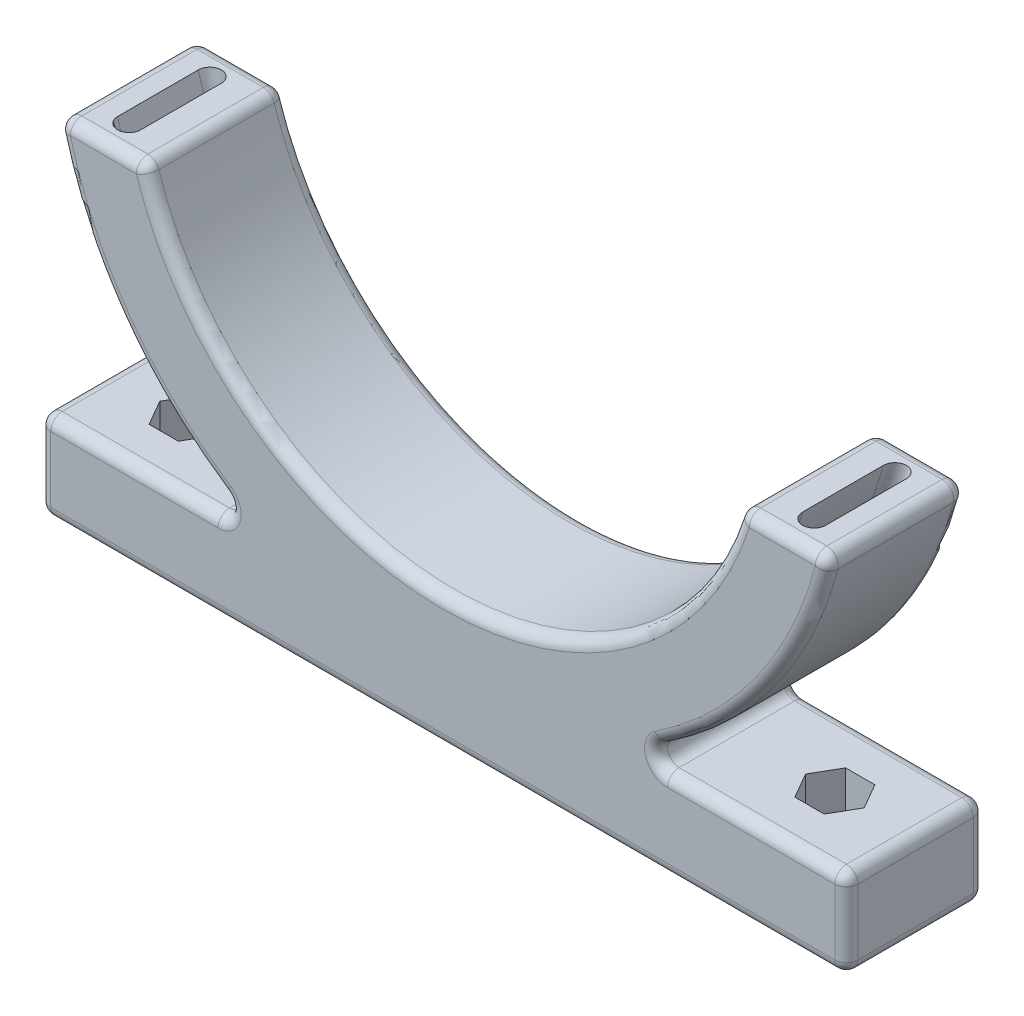
from build123d import *

# Parameters (mm, degrees)
BOSS_EXTRUDE1_DEPTH          = 15.24
FILLET1_R                    = 2.54
CUT_EXTRUDE1_DEPTH           = 10.16
H_0_266_DIAMETER_HOLE1_D     = 6.7564
H_0_266_DIAMETER_HOLE1_DEPTH = 19.558


with BuildPart() as part:
    # Sketch1 → Boss-Extrude1 (new, symmetric)
    with BuildSketch(Plane.XY):
        with BuildLine():
            Line((-85.274045735, -19.05), (-65.616612043, -19.05))
            ThreePointArc((-65.616612043, -19.05), (0, -68.326), (65.616612043, -19.05))
            Line((65.616612043, -19.05), (85.274045735, -19.05))
            ThreePointArc((85.274045735, -19.05), (0, -87.376), (-85.274045735, -19.05))
        make_face()
        with BuildLine():
            ThreePointArc((40.165544525, -77.597), (0, -87.376), (-40.165544525, -77.597))
            Line((-40.165544525, -77.597), (-88.9, -77.597))
            Line((-88.9, -77.597), (-88.9, -97.155))
            Line((-88.9, -97.155), (88.9, -97.155))
            Line((88.9, -97.155), (88.9, -77.597))
            Line((88.9, -77.597), (40.165544525, -77.597))
        make_face()
    extrude(amount=BOSS_EXTRUDE1_DEPTH, both=True)

    # Cut-Sweep1: sweep along a path in Sketch4
    with BuildLine(Plane.XY) as cut_sweep1_path:
        CenterArc((0, 0), 77.978, 0, 360)
    # Sketch3 → Cut-Sweep1 (sweep, cut)
    with BuildSketch(Plane(origin=(0, -19.05, 0), x_dir=(1, 0, 0), z_dir=(0, 1, 0))):
        with BuildLine():
            Line((-77.985328889, -8.89), (-77.985328889, 8.89))
            ThreePointArc((-77.985328889, 8.89), (-75.445328889, 11.43), (-72.905328889, 8.89))
            Line((-72.905328889, 8.89), (-72.905328889, -8.89))
            ThreePointArc((-72.905328889, -8.89), (-75.445328889, -11.43), (-77.985328889, -8.89))
        make_face()
    sweep(path=cut_sweep1_path.line, mode=Mode.SUBTRACT)

    # Fillet1
    fillet1_edges = [part.edges().sort_by_distance(p)[0] for p in [
        (0, -68.326, -15.24),
        (75.445328889, -19.05, -15.24),
        (69.214958668, -53.327805811, -15.24),
        (64.532772263, -77.597, -15.24),
        (-64.532772263, -77.597, 15.24),
        (88.9, -87.376, -15.24),
        (0, -97.155, -15.24),
        (-88.9, -87.376, -15.24),
        (-64.532772263, -77.597, -15.24),
        (-69.214958668, -53.327805811, -15.24),
        (-75.445328889, -19.05, -15.24),
        (-88.9, -87.376, 15.24),
        (-65.616612043, -19.05, 0),
        (65.616612043, -19.05, 0),
        (85.274045735, -19.05, 0),
        (40.165544525, -77.597, 0),
        (88.9, -77.597, 0),
        (88.9, -97.155, 0),
        (-88.9, -97.155, 0),
        (-88.9, -77.597, 0),
        (-40.165544525, -77.597, 0),
        (-85.274045735, -19.05, 0),
        (0, -97.155, 15.24),
        (88.9, -87.376, 15.24),
        (64.532772263, -77.597, 15.24),
        (69.214958668, -53.327805811, 15.24),
        (75.445328889, -19.05, 15.24),
        (0, -68.326, 15.24),
        (-75.445328889, -19.05, 15.24),
        (-69.214958668, -53.327805811, 15.24),
    ]]
    fillet(fillet1_edges, radius=FILLET1_R)

    # Sketch5 → Cut-Extrude1 (cut)
    with BuildSketch(Plane(origin=(0, -77.597, 0), x_dir=(1, 0, 0), z_dir=(0, 1, 0))):
        Polygon((-67.893766696, 5.588), (-74.346233304, 5.588), (-77.572466608, 0), (-74.346233304, -5.588), (-67.893766696, -5.588), (-64.667533392, 0), align=None)
        Polygon((74.346233304, 5.588), (67.893766696, 5.588), (64.667533392, 0), (67.893766696, -5.588), (74.346233304, -5.588), (77.572466608, 0), align=None)
    extrude(amount=-CUT_EXTRUDE1_DEPTH, mode=Mode.SUBTRACT)

    # H (0.266) Diameter Hole1
    with Locations(Plane(origin=(-71.12, -77.597, 0), x_dir=(0, 0, 1), z_dir=(0, 1, 0))):
        with Locations((0, 0), (0, 142.24)):
            Hole(H_0_266_DIAMETER_HOLE1_D / 2, depth=H_0_266_DIAMETER_HOLE1_DEPTH)


solid = part.part
